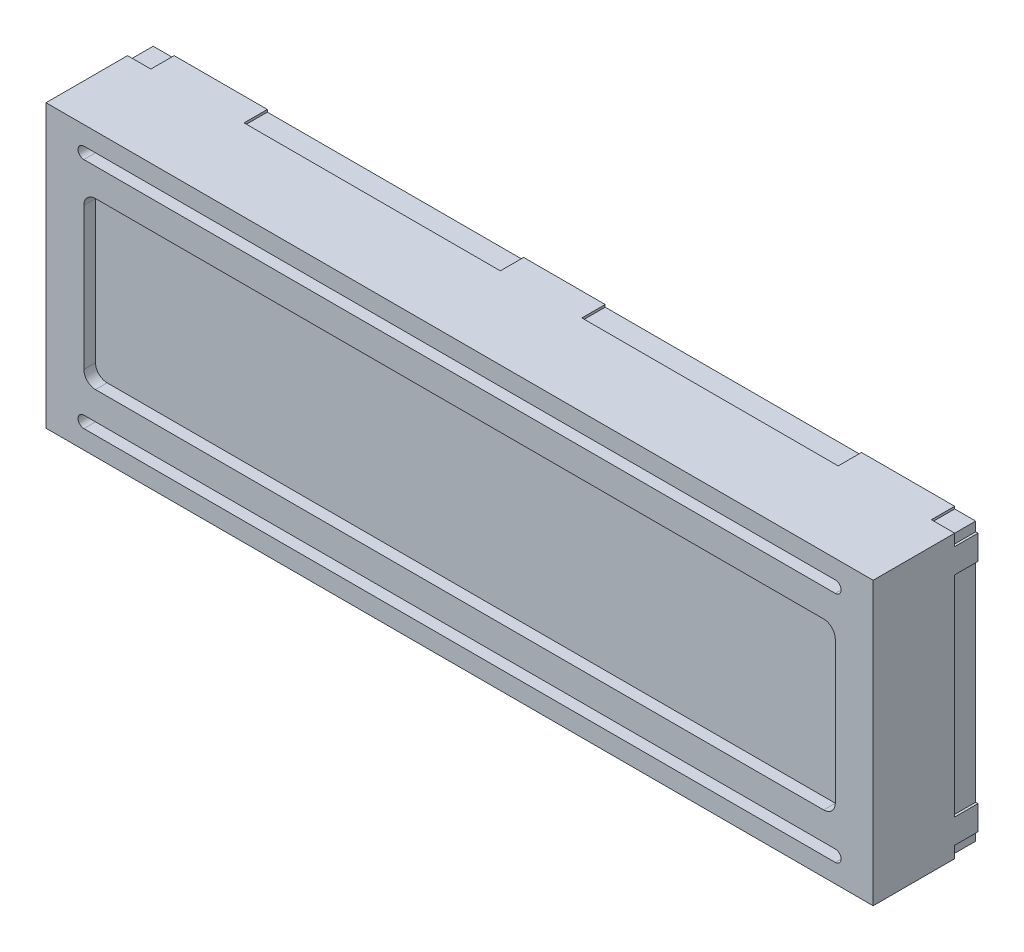
from build123d import *

# Parameters (mm, degrees)
ESQUISSE1_W             = 71
ESQUISSE1_H             = 24.2
BOSS_EXTRU_1_DEPTH      = 9
ENL_V_MAT_EXTRU_1_DEPTH = 1
ENL_V_MAT_EXTRU_2_DEPTH = 1
ESQUISSE4_W             = 22
ESQUISSE4_H             = 4
ESQUISSE4_W_2           = 4
ENL_V_MAT_EXTRU_3_DEPTH = 0.2
ESQUISSE5_W             = 4
ESQUISSE5_H             = 1
ESQUISSE5_H_2           = 18
ENL_V_MAT_EXTRU_4_DEPTH = 0.2


with BuildPart() as part:
    # Esquisse1 → Boss.-Extru.1 (new body)
    with BuildSketch(Plane.XY):
        Rectangle(ESQUISSE1_W, ESQUISSE1_H)
    extrude(amount=BOSS_EXTRU_1_DEPTH)

    # Esquisse2 → Enlèv. mat.-Extru.1 (cut)
    with BuildSketch(Plane.XY.offset(9)):
        with BuildLine():
            Line((-31.25, 7.1), (31.25, 7.1))
            ThreePointArc((31.25, 7.1), (31.957106781, 6.807106781), (32.25, 6.1))
            Line((32.25, 6.1), (32.25, -6.1))
            ThreePointArc((32.25, -6.1), (31.957106781, -6.807106781), (31.25, -7.1))
            Line((31.25, -7.1), (-31.25, -7.1))
            ThreePointArc((-31.25, -7.1), (-31.957106781, -6.807106781), (-32.25, -6.1))
            Line((-32.25, -6.1), (-32.25, 6.1))
            ThreePointArc((-32.25, 6.1), (-31.957106781, 6.807106781), (-31.25, 7.1))
        make_face()
    extrude(amount=-ENL_V_MAT_EXTRU_1_DEPTH, mode=Mode.SUBTRACT)

    # Esquisse3 → Enlèv. mat.-Extru.2 (cut)
    with BuildSketch(Plane.XY.offset(9)):
        with BuildLine():
            Line((-32.25, 10.5), (32.25, 10.5))
            ThreePointArc((32.25, 10.5), (32.75, 10), (32.25, 9.5))
            Line((32.25, 9.5), (-32.25, 9.5))
            ThreePointArc((-32.25, 9.5), (-32.75, 10), (-32.25, 10.5))
        make_face()
        with BuildLine():
            Line((-32.25, -10.5), (32.25, -10.5))
            ThreePointArc((32.25, -10.5), (32.75, -10), (32.25, -9.5))
            Line((32.25, -9.5), (-32.25, -9.5))
            ThreePointArc((-32.25, -9.5), (-32.75, -10), (-32.25, -10.5))
        make_face()
    extrude(amount=-ENL_V_MAT_EXTRU_2_DEPTH, mode=Mode.SUBTRACT)

    # Esquisse4 → Enlèv. mat.-Extru.3 (cut)
    with BuildSketch(Plane.XZ.offset(12.1)):
        with Locations((14.5, 0)):
            Rectangle(ESQUISSE4_W, ESQUISSE4_H)
        with Locations((-14.5, 0)):
            Rectangle(ESQUISSE4_W, ESQUISSE4_H)
        with Locations((35.5, 0)):
            Rectangle(ESQUISSE4_W_2, ESQUISSE4_H)
        with Locations((-35.5, 0)):
            Rectangle(ESQUISSE4_W_2, ESQUISSE4_H)
    enl_v_mat_extru_3 = extrude(amount=-ENL_V_MAT_EXTRU_3_DEPTH, mode=Mode.SUBTRACT)

    # Symétrie1: Enlèv. mat.-Extru.3 across plane
    add(enl_v_mat_extru_3.mirror(Plane.ZX), mode=Mode.SUBTRACT)

    # Esquisse5 → Enlèv. mat.-Extru.4 (cut)
    with BuildSketch(Plane(origin=(35.5, 0, 0), x_dir=(0, 0, -1), z_dir=(1, 0, 0))):
        with Locations((0, 11.6)):
            Rectangle(ESQUISSE5_W, ESQUISSE5_H)
        Rectangle(ESQUISSE5_W, ESQUISSE5_H_2)
        with Locations((0, -11.6)):
            Rectangle(ESQUISSE5_W, ESQUISSE5_H)
    enl_v_mat_extru_4 = extrude(amount=-ENL_V_MAT_EXTRU_4_DEPTH, mode=Mode.SUBTRACT)

    # Symétrie2: Enlèv. mat.-Extru.4 across plane
    add(enl_v_mat_extru_4.mirror(Plane(origin=(0, 0, 0), x_dir=(0, 0, 1), z_dir=(1, 0, 0))), mode=Mode.SUBTRACT)


solid = part.part
